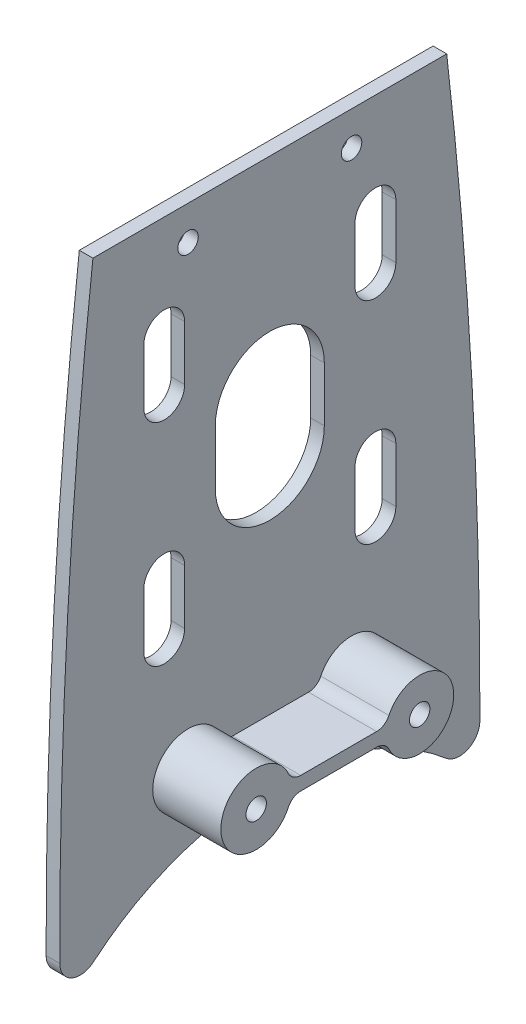
from build123d import *

# Parameters (mm, degrees)
SKETCH1_R           = 1.5
BOSS_EXTRUDE1_DEPTH = 2
SKETCH2_R           = 1.5
BOSS_EXTRUDE2_DEPTH = 10
FILLET1_R           = 2


with BuildPart() as part:
    # Sketch1 → Boss-Extrude1 (new body)
    with BuildSketch(Plane(origin=(0, 0, 0), x_dir=(0, 0, -1), z_dir=(1, 0, 0))):
        with BuildLine():
            Line((-25.968110327, 120), (25.968110327, 120))
            ThreePointArc((25.968110327, 120), (29.67212348, 76.455251784), (30.833602138, 32.768688884))
            ThreePointArc((30.833602138, 32.768688884), (29.089961469, 30.052105348), (25.891732052, 30.48964105))
            ThreePointArc((25.891732052, 30.48964105), (0, 40), (-25.891732052, 30.48964105))
            ThreePointArc((-25.891732052, 30.48964105), (-29.089961469, 30.052105348), (-30.833602138, 32.768688884))
            ThreePointArc((-30.833602138, 32.768688884), (-29.67212348, 76.455251784), (-25.968110327, 120))
        make_face()
        with Locations((-12, 115)):
            Circle(SKETCH1_R, mode=Mode.SUBTRACT)
        with Locations((12, 115)):
            Circle(SKETCH1_R, mode=Mode.SUBTRACT)
        with Locations((-12, 48)):
            Circle(SKETCH1_R, mode=Mode.SUBTRACT)
        with Locations((12, 48)):
            Circle(SKETCH1_R, mode=Mode.SUBTRACT)
        with BuildLine():
            Line((8, 89.7), (8, 81.7))
            ThreePointArc((8, 81.7), (0, 73.7), (-8, 81.7))
            Line((-8, 81.7), (-8, 89.7))
            ThreePointArc((-8, 89.7), (0, 97.7), (8, 89.7))
        make_face(mode=Mode.SUBTRACT)
        with BuildLine():
            Line((18.5, 105.2), (18.5, 97.2))
            ThreePointArc((18.5, 97.2), (15.5, 94.2), (12.5, 97.2))
            Line((12.5, 97.2), (12.5, 105.2))
            ThreePointArc((12.5, 105.2), (15.5, 108.2), (18.5, 105.2))
        make_face(mode=Mode.SUBTRACT)
        with BuildLine():
            Line((18.5, 74.2), (18.5, 66.2))
            ThreePointArc((18.5, 66.2), (15.5, 63.2), (12.5, 66.2))
            Line((12.5, 66.2), (12.5, 74.2))
            ThreePointArc((12.5, 74.2), (15.5, 77.2), (18.5, 74.2))
        make_face(mode=Mode.SUBTRACT)
        with BuildLine():
            Line((-12.5, 105.2), (-12.5, 97.2))
            ThreePointArc((-12.5, 97.2), (-15.5, 94.2), (-18.5, 97.2))
            Line((-18.5, 97.2), (-18.5, 105.2))
            ThreePointArc((-18.5, 105.2), (-15.5, 108.2), (-12.5, 105.2))
        make_face(mode=Mode.SUBTRACT)
        with BuildLine():
            Line((-12.5, 74.2), (-12.5, 66.2))
            ThreePointArc((-12.5, 66.2), (-15.5, 63.2), (-18.5, 66.2))
            Line((-18.5, 66.2), (-18.5, 74.2))
            ThreePointArc((-18.5, 74.2), (-15.5, 77.2), (-12.5, 74.2))
        make_face(mode=Mode.SUBTRACT)
    extrude(amount=BOSS_EXTRUDE1_DEPTH)

    # Sketch2 → Boss-Extrude2 (add)
    with BuildSketch(Plane(origin=(2, 0, 0), x_dir=(0, 0, -1), z_dir=(1, 0, 0))):
        with BuildLine():
            Line((-6.910390688, 49), (7.101020514, 49))
            ThreePointArc((7.101020514, 49), (17, 48), (7.101020514, 47))
            Line((7.101020514, 47), (-6.910390688, 47))
            ThreePointArc((-6.910390688, 47), (-17.186918444, 48), (-6.910390688, 49))
        make_face()
        with Locations((-12, 48)):
            Circle(SKETCH2_R, mode=Mode.SUBTRACT)
        with Locations((12, 48)):
            Circle(SKETCH2_R, mode=Mode.SUBTRACT)
    extrude(amount=BOSS_EXTRUDE2_DEPTH)

    # Fillet1
    fillet1_edges = [part.edges().sort_by_distance(p)[0] for p in [
        (7, 49, 6.910390688),
        (7, 47, 6.910390688),
        (7, 47, -7.101020514),
        (7, 49, -7.101020514),
    ]]
    fillet(fillet1_edges, radius=FILLET1_R)


solid = part.part
